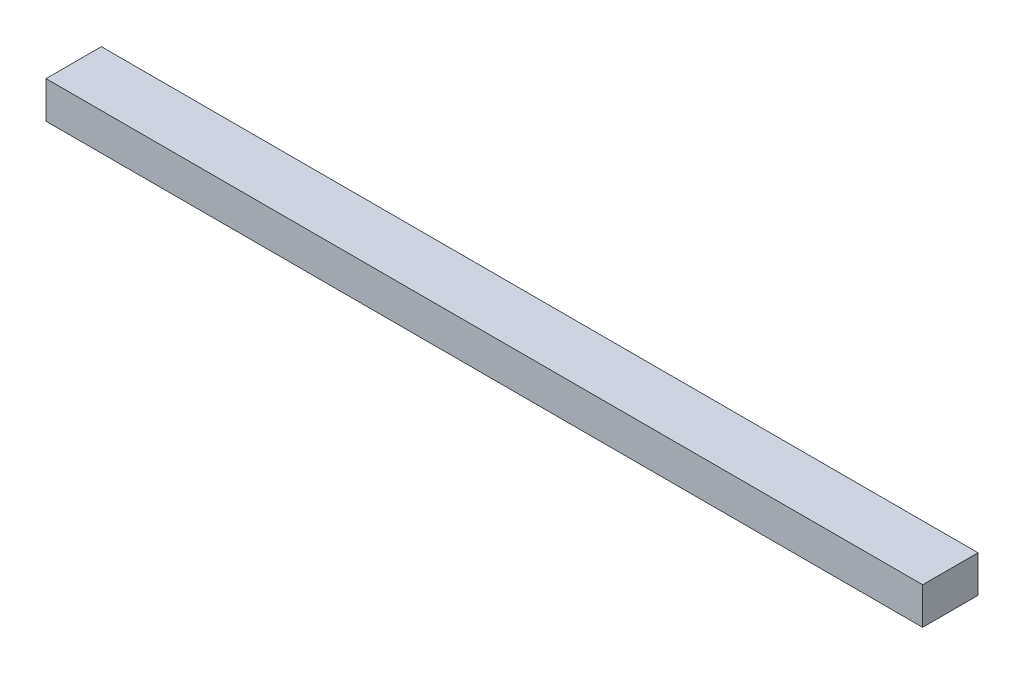
from build123d import *

# Parameters (mm, degrees)
SKETCH1_W           = 1206.5
SKETCH1_H           = 76.2
BOSS_EXTRUDE1_DEPTH = 50.8


with BuildPart() as part:
    # Sketch1 → Boss-Extrude1 (new body)
    with BuildSketch(Plane(origin=(0, 0, 0), x_dir=(1, 0, 0), z_dir=(0, 1, 0))):
        Rectangle(SKETCH1_W, SKETCH1_H)
    extrude(amount=BOSS_EXTRUDE1_DEPTH)


solid = part.part
